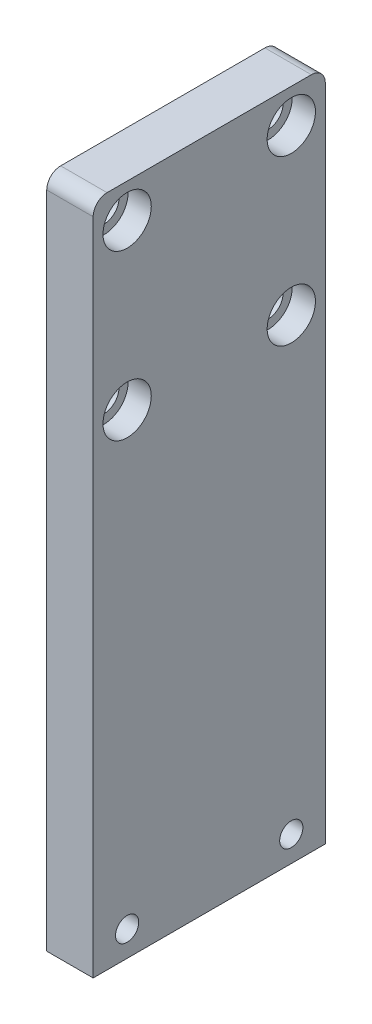
from build123d import *

# Parameters (mm, degrees)
CROQUIS1_R              = 3.25
CROQUIS1_R_2            = 2.5
SALIENTE_EXTRUIR1_DEPTH = 10
CROQUIS5_R              = 5.2
CORTAR_EXTRUIR2_DEPTH   = 5
FILLET1_R               = 3
SKETCH1_R               = 4.425
CUT_EXTRUDE1_DEPTH      = 5


with BuildPart() as part:
    # Croquis1 → Saliente-Extruir1 (new body)
    with BuildSketch(Plane(origin=(0, 0, 0), x_dir=(0, 0, -1), z_dir=(1, 0, 0))):
        Polygon((-25, -120), (25, -120), (25, 25), (0, 25), (-25, 25), (-25, 0), align=None)
        with Locations((-17.68, 17.68)):
            Circle(CROQUIS1_R, mode=Mode.SUBTRACT)
        with Locations(Location((17.68, 17.68, 0), (0, 0, 180))):
            Circle(CROQUIS1_R, mode=Mode.SUBTRACT)
        with Locations((17.68, -17.68)):
            Circle(CROQUIS1_R, mode=Mode.SUBTRACT)
        with Locations(Location((-17.68, -17.68, 0), (0, 0, 180))):
            Circle(CROQUIS1_R, mode=Mode.SUBTRACT)
        with Locations((-17.68, -114.5)):
            Circle(CROQUIS1_R_2, mode=Mode.SUBTRACT)
        with Locations(Location((17.68, -114.5, 0), (0, 0, 180))):
            Circle(CROQUIS1_R_2, mode=Mode.SUBTRACT)
    extrude(amount=SALIENTE_EXTRUIR1_DEPTH)

    # Croquis5 → Cortar-Extruir2 (cut)
    with BuildSketch(Plane(origin=(10, 0, 0), x_dir=(0, 0, -1), z_dir=(1, 0, 0))):
        with Locations((17.68, 17.68)):
            Circle(CROQUIS5_R)
        with Locations((-17.68, 17.68)):
            Circle(CROQUIS5_R)
        with Locations((-17.68, -17.68)):
            Circle(CROQUIS5_R)
        with Locations((17.68, -17.68)):
            Circle(CROQUIS5_R)
    extrude(amount=-CORTAR_EXTRUIR2_DEPTH, mode=Mode.SUBTRACT)

    # Fillet1
    fillet1_edges = [part.edges().sort_by_distance(p)[0] for p in [
        (5, 25, -25),
        (5, 25, 25),
    ]]
    fillet(fillet1_edges, radius=FILLET1_R)

    # Sketch1 → Cut-Extrude1 (cut)
    with BuildSketch(Plane.ZY):
        with Locations((17.68, -114.5)):
            Circle(SKETCH1_R)
        with Locations(Location((-17.68, -114.5, 0), (0, 0, 180))):
            Circle(SKETCH1_R)
    extrude(amount=-CUT_EXTRUDE1_DEPTH, mode=Mode.SUBTRACT)


solid = part.part
